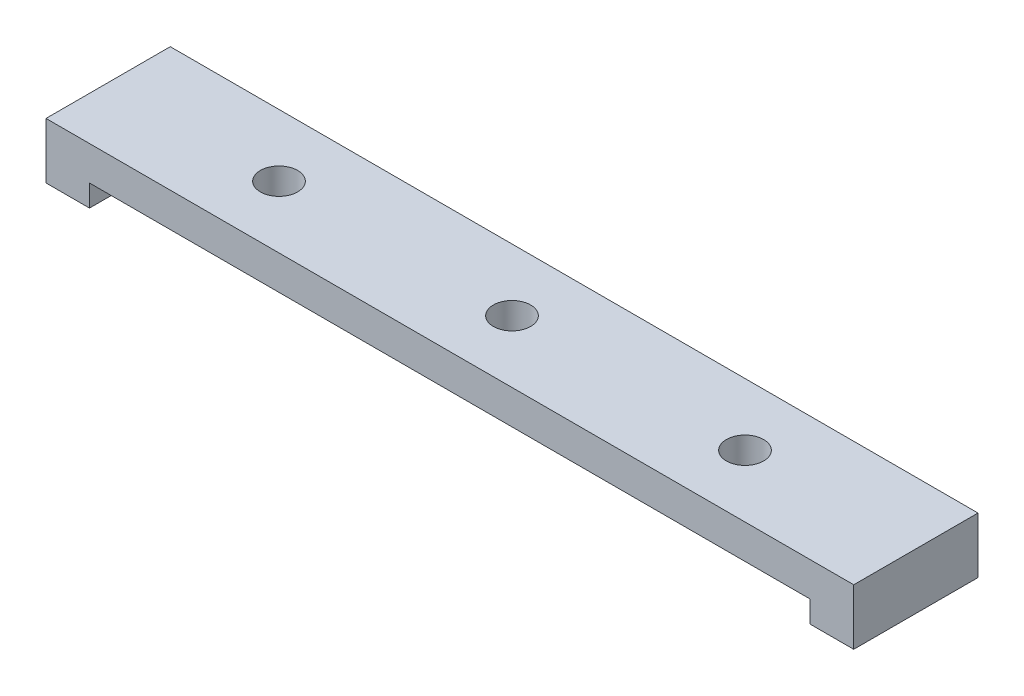
from build123d import *

# Parameters (mm, degrees)
SKETCH1_W           = 65
SKETCH1_H           = 10
SKETCH1_R           = 1.5
BOSS_EXTRUDE1_DEPTH = 4.5
SKETCH2_W           = 58
SKETCH2_H           = 10
CUT_EXTRUDE1_DEPTH  = 1.75


with BuildPart() as part:
    # Sketch1 → Boss-Extrude1 (new body)
    with BuildSketch(Plane(origin=(0, 0, 0), x_dir=(1, 0, 0), z_dir=(0, 1, 0))):
        with Locations((32.5, 5)):
            Rectangle(SKETCH1_W, SKETCH1_H)
        with Locations(Location((13.75, 5, 0), (0, 0, 270))):
            Circle(SKETCH1_R, mode=Mode.SUBTRACT)
        with Locations(Location((32.5, 5, 0), (0, 0, 270))):
            Circle(SKETCH1_R, mode=Mode.SUBTRACT)
        with Locations(Location((51.25, 5, 0), (0, 0, 270))):
            Circle(SKETCH1_R, mode=Mode.SUBTRACT)
    extrude(amount=BOSS_EXTRUDE1_DEPTH)

    # Sketch2 → Cut-Extrude1 (cut)
    with BuildSketch(Plane.XZ):
        with Locations((32.5, -5)):
            Rectangle(SKETCH2_W, SKETCH2_H)
    extrude(amount=-CUT_EXTRUDE1_DEPTH, mode=Mode.SUBTRACT)


solid = part.part
